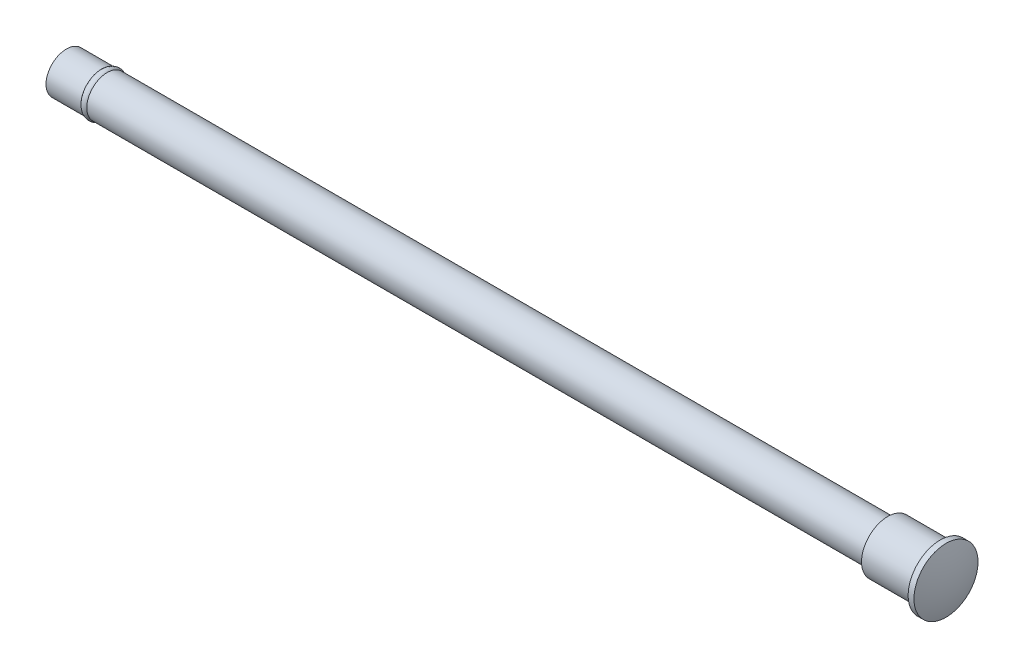
from build123d import *

# Parameters (mm, degrees)
SKETCH3_R          = 2.2
CUT_EXTRUDE1_DEPTH = 150


with BuildPart() as part:
    # Sketch1 → Revolve1 (revolve)
    with BuildSketch(Plane.XY, mode=Mode.PRIVATE) as revolve1_sk:
        with BuildLine():
            Line((0, 0), (152, 0))
            ThreePointArc((152, 0), (151.747967345, 2.795084972), (151, 5.5))
            Line((151, 5.5), (150, 5.5))
            Line((150, 5.5), (150, 4.5))
            Line((150, 4.5), (141, 4.5))
            Line((141, 4.5), (141, 3.5))
            Line((141, 3.5), (0, 3.5))
            Line((0, 3.5), (0, 0))
        make_face()
    revolve(revolve1_sk.sketch.rotate(Axis((0, 0, 0), (1, 0, 0)), 90), axis=Axis((0, 0, 0), (1, 0, 0)))

    # Sketch2 → Revolve2 (revolve)
    with BuildSketch(Plane.XY, mode=Mode.PRIVATE) as revolve2_sk:
        with BuildLine():
            Line((6, 0), (7, 0))
            Line((7, 0), (7, 3.5))
            ThreePointArc((7, 3.5), (6.5, 3.7), (6, 3.5))
            Line((6, 3.5), (6, 0))
        make_face()
    revolve(revolve2_sk.sketch.rotate(Axis((6, 0, 0), (1, 0, 0)), 90), axis=Axis((6, 0, 0), (1, 0, 0)))

    # Sketch3 → Cut-Extrude1 (cut)
    with BuildSketch(Plane.ZY):
        Circle(SKETCH3_R)
    extrude(amount=-CUT_EXTRUDE1_DEPTH, mode=Mode.SUBTRACT)


solid = part.part
